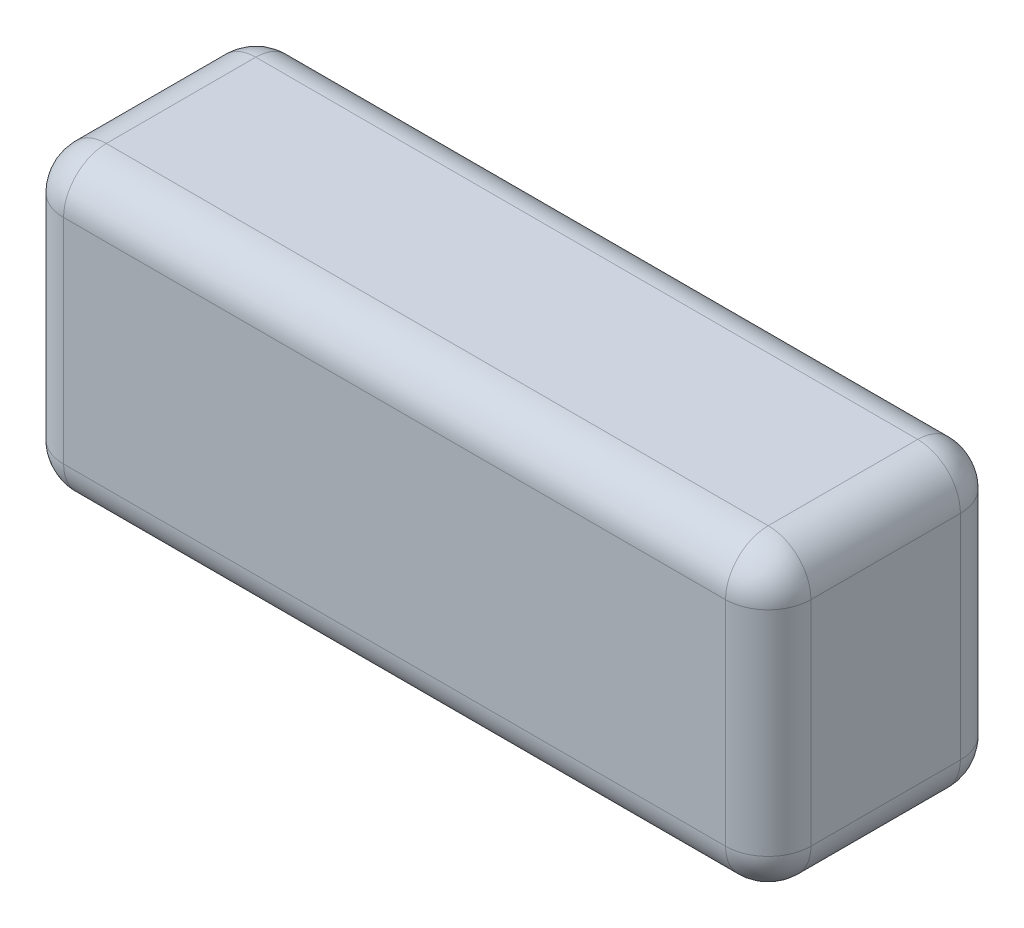
from build123d import *

# Parameters (mm, degrees)
SKETCH1_W           = 140
SKETCH1_H           = 44
BOSS_EXTRUDE1_DEPTH = 56
FILLET1_R           = 8
SKETCH2_R           = 0.907650606
BOSS_EXTRUDE2_DEPTH = 1


with BuildPart() as part:
    # Sketch1 → Boss-Extrude1 (new body)
    with BuildSketch(Plane(origin=(0, 0, 0), x_dir=(1, 0, 0), z_dir=(0, 1, 0))):
        Rectangle(SKETCH1_W, SKETCH1_H)
    extrude(amount=BOSS_EXTRUDE1_DEPTH)

    # Fillet1
    fillet1_edges = [part.edges().sort_by_distance(p)[0] for p in [
        (-70, 56, 0),
        (0, 56, 22),
        (70, 56, 0),
        (0, 0, 22),
        (-70, 0, 0),
        (0, 0, -22),
        (70, 0, 0),
        (0, 56, -22),
        (70, 28, 22),
        (-70, 28, 22),
        (-70, 28, -22),
        (70, 28, -22),
    ]]
    fillet(fillet1_edges, radius=FILLET1_R)

    # Sketch2 → Boss-Extrude2 (add)
    with BuildSketch(Plane(origin=(0, 0, -22), x_dir=(-1, 0, 0), z_dir=(0, 0, -1))):
        with Locations(Location((0, 28, 0), (0, 0, 180))):
            Circle(SKETCH2_R)
    extrude(amount=BOSS_EXTRUDE2_DEPTH)


solid = part.part
